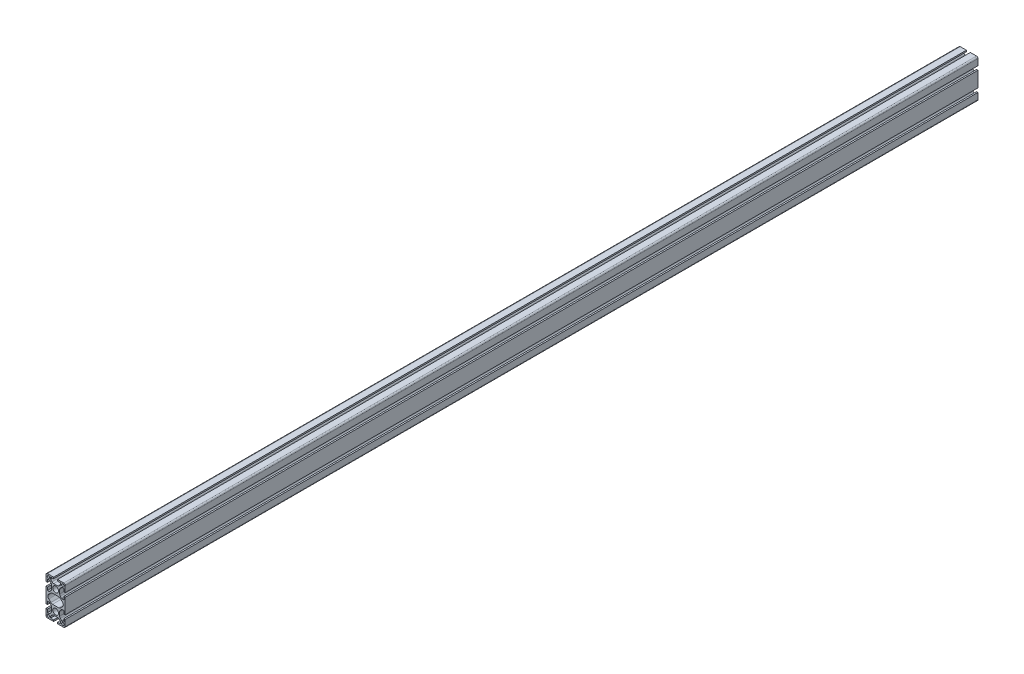
from build123d import *

# Parameters (mm, degrees)
SKETCH1_R           = 2.5
SKETCH1_R_2         = 6
BOSS_EXTRUDE1_DEPTH = 1900


with BuildPart() as part:
    # Sketch1 → Boss-Extrude1 (new body)
    with BuildSketch(Plane.XY):
        with BuildLine():
            Line((-17, -40), (-4.1, -40))
            Line((-4.1, -40), (-4.1, -37))
            Line((-4.1, -37), (-10.5, -37))
            Line((-10.5, -37), (-10.5, -33.6627417))
            ThreePointArc((-10.5, -33.6627417), (-10.378207252, -33.050448208), (-10.03137085, -32.53137085))
            Line((-10.03137085, -32.53137085), (-7.464466094, -29.964466094))
            ThreePointArc((-7.464466094, -29.964466094), (-5.84234935, -28.880602337), (-3.928932188, -28.5))
            Line((-3.928932188, -28.5), (3.928932188, -28.5))
            ThreePointArc((3.928932188, -28.5), (5.84234935, -28.880602337), (7.464466094, -29.964466094))
            Line((7.464466094, -29.964466094), (10.03137085, -32.53137085))
            ThreePointArc((10.03137085, -32.53137085), (10.378207252, -33.050448208), (10.5, -33.6627417))
            Line((10.5, -33.6627417), (10.5, -37))
            Line((10.5, -37), (4.1, -37))
            Line((4.1, -37), (4.1, -40))
            Line((4.1, -40), (17, -40))
            ThreePointArc((17, -40), (19.121320344, -39.121320344), (20, -37))
            Line((20, -37), (20, -24.1))
            Line((20, -24.1), (17, -24.1))
            Line((17, -24.1), (17, -30.5))
            Line((17, -30.5), (13.6627417, -30.5))
            ThreePointArc((13.6627417, -30.5), (13.050448208, -30.378207252), (12.53137085, -30.03137085))
            Line((12.53137085, -30.03137085), (9.964466094, -27.464466094))
            ThreePointArc((9.964466094, -27.464466094), (8.880602337, -25.84234935), (8.5, -23.928932188))
            Line((8.5, -23.928932188), (8.5, -16.071067812))
            ThreePointArc((8.5, -16.071067812), (8.880602337, -14.15765065), (9.964466094, -12.535533906))
            Line((9.964466094, -12.535533906), (12.53137085, -9.96862915))
            ThreePointArc((12.53137085, -9.96862915), (13.050448208, -9.621792748), (13.6627417, -9.5))
            Line((13.6627417, -9.5), (17, -9.5))
            Line((17, -9.5), (17, -15.9))
            Line((17, -15.9), (20, -15.9))
            Line((20, -15.9), (20, 15.9))
            Line((20, 15.9), (17, 15.9))
            Line((17, 15.9), (17, 9.5))
            Line((17, 9.5), (13.6627417, 9.5))
            ThreePointArc((13.6627417, 9.5), (13.050448208, 9.621792748), (12.53137085, 9.96862915))
            Line((12.53137085, 9.96862915), (9.964466094, 12.535533906))
            ThreePointArc((9.964466094, 12.535533906), (8.880602337, 14.15765065), (8.5, 16.071067812))
            Line((8.5, 16.071067812), (8.5, 23.928932188))
            ThreePointArc((8.5, 23.928932188), (8.880602337, 25.84234935), (9.964466094, 27.464466094))
            Line((9.964466094, 27.464466094), (12.53137085, 30.03137085))
            ThreePointArc((12.53137085, 30.03137085), (13.050448208, 30.378207252), (13.6627417, 30.5))
            Line((13.6627417, 30.5), (17, 30.5))
            Line((17, 30.5), (17, 24.1))
            Line((17, 24.1), (20, 24.1))
            Line((20, 24.1), (20, 37))
            ThreePointArc((20, 37), (19.121320344, 39.121320344), (17, 40))
            Line((17, 40), (4.1, 40))
            Line((4.1, 40), (4.1, 37))
            Line((4.1, 37), (10.5, 37))
            Line((10.5, 37), (10.5, 33.6627417))
            ThreePointArc((10.5, 33.6627417), (10.378207252, 33.050448208), (10.03137085, 32.53137085))
            Line((10.03137085, 32.53137085), (7.464466094, 29.964466094))
            ThreePointArc((7.464466094, 29.964466094), (5.84234935, 28.880602337), (3.928932188, 28.5))
            Line((3.928932188, 28.5), (-3.928932188, 28.5))
            ThreePointArc((-3.928932188, 28.5), (-5.84234935, 28.880602337), (-7.464466094, 29.964466094))
            Line((-7.464466094, 29.964466094), (-10.03137085, 32.53137085))
            ThreePointArc((-10.03137085, 32.53137085), (-10.378207252, 33.050448208), (-10.5, 33.6627417))
            Line((-10.5, 33.6627417), (-10.5, 37))
            Line((-10.5, 37), (-4.1, 37))
            Line((-4.1, 37), (-4.1, 40))
            Line((-4.1, 40), (-17, 40))
            ThreePointArc((-17, 40), (-19.121320344, 39.121320344), (-20, 37))
            Line((-20, 37), (-20, 24.1))
            Line((-20, 24.1), (-17, 24.1))
            Line((-17, 24.1), (-17, 30.5))
            Line((-17, 30.5), (-13.6627417, 30.5))
            ThreePointArc((-13.6627417, 30.5), (-13.050448208, 30.378207252), (-12.53137085, 30.03137085))
            Line((-12.53137085, 30.03137085), (-9.964466094, 27.464466094))
            ThreePointArc((-9.964466094, 27.464466094), (-8.880602337, 25.84234935), (-8.5, 23.928932188))
            Line((-8.5, 23.928932188), (-8.5, 16.071067812))
            ThreePointArc((-8.5, 16.071067812), (-8.880602337, 14.15765065), (-9.964466094, 12.535533906))
            Line((-9.964466094, 12.535533906), (-12.53137085, 9.96862915))
            ThreePointArc((-12.53137085, 9.96862915), (-13.050448208, 9.621792748), (-13.6627417, 9.5))
            Line((-13.6627417, 9.5), (-17, 9.5))
            Line((-17, 9.5), (-17, 15.9))
            Line((-17, 15.9), (-20, 15.9))
            Line((-20, 15.9), (-20, -15.9))
            Line((-20, -15.9), (-17, -15.9))
            Line((-17, -15.9), (-17, -9.5))
            Line((-17, -9.5), (-13.6627417, -9.5))
            ThreePointArc((-13.6627417, -9.5), (-13.050448208, -9.621792748), (-12.53137085, -9.96862915))
            Line((-12.53137085, -9.96862915), (-9.964466094, -12.535533906))
            ThreePointArc((-9.964466094, -12.535533906), (-8.880602337, -14.15765065), (-8.5, -16.071067812))
            Line((-8.5, -16.071067812), (-8.5, -23.928932188))
            ThreePointArc((-8.5, -23.928932188), (-8.880602337, -25.84234935), (-9.964466094, -27.464466094))
            Line((-9.964466094, -27.464466094), (-12.53137085, -30.03137085))
            ThreePointArc((-12.53137085, -30.03137085), (-13.050448208, -30.378207252), (-13.6627417, -30.5))
            Line((-13.6627417, -30.5), (-17, -30.5))
            Line((-17, -30.5), (-17, -24.1))
            Line((-17, -24.1), (-20, -24.1))
            Line((-20, -24.1), (-20, -37))
            ThreePointArc((-20, -37), (-19.121320344, -39.121320344), (-17, -40))
        make_face()
        with Locations((15, 35)):
            Circle(SKETCH1_R, mode=Mode.SUBTRACT)
        with Locations((15, -35)):
            Circle(SKETCH1_R, mode=Mode.SUBTRACT)
        with Locations((0, 20)):
            Circle(SKETCH1_R_2, mode=Mode.SUBTRACT)
        with Locations((0, -20)):
            Circle(SKETCH1_R_2, mode=Mode.SUBTRACT)
        with Locations((-15, 35)):
            Circle(SKETCH1_R, mode=Mode.SUBTRACT)
        with Locations((-15, -35)):
            Circle(SKETCH1_R, mode=Mode.SUBTRACT)
        with BuildLine():
            Line((-14.242640687, -4.242640687), (-9.949747468, -8.535533906))
            ThreePointArc((-9.949747468, -8.535533906), (-8.327630724, -9.619397663), (-6.414213562, -10))
            Line((-6.414213562, -10), (6.414213562, -10))
            ThreePointArc((6.414213562, -10), (8.327630724, -9.619397663), (9.949747468, -8.535533906))
            Line((9.949747468, -8.535533906), (14.242640687, -4.242640687))
            ThreePointArc((14.242640687, -4.242640687), (16, 0), (14.242640687, 4.242640687))
            Line((14.242640687, 4.242640687), (9.949747468, 8.535533906))
            ThreePointArc((9.949747468, 8.535533906), (8.327630724, 9.619397663), (6.414213562, 10))
            Line((6.414213562, 10), (-6.414213562, 10))
            ThreePointArc((-6.414213562, 10), (-8.327630724, 9.619397663), (-9.949747468, 8.535533906))
            Line((-9.949747468, 8.535533906), (-14.242640687, 4.242640687))
            ThreePointArc((-14.242640687, 4.242640687), (-16, 0), (-14.242640687, -4.242640687))
        make_face(mode=Mode.SUBTRACT)
    extrude(amount=-BOSS_EXTRUDE1_DEPTH)


solid = part.part
